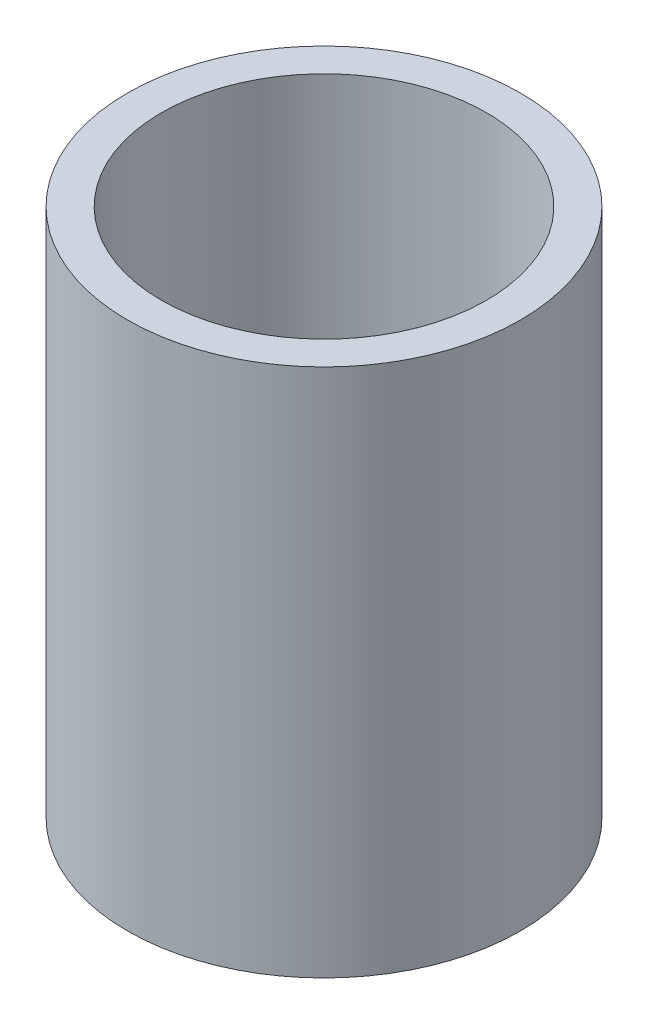
from build123d import *

# Parameters (mm, degrees)
SKETCH1_R           = 13
SKETCH1_R_2         = 10.75
BOSS_EXTRUDE1_DEPTH = 35


with BuildPart() as part:
    # Sketch1 → Boss-Extrude1 (new body)
    with BuildSketch(Plane(origin=(0, 0, 0), x_dir=(1, 0, 0), z_dir=(0, 1, 0))):
        with Locations(Location((0, 0, 0), (0, 0, 270))):
            Circle(SKETCH1_R)
        with Locations(Location((0, 0, 0), (0, 0, 270))):
            Circle(SKETCH1_R_2, mode=Mode.SUBTRACT)
    extrude(amount=BOSS_EXTRUDE1_DEPTH)


solid = part.part
